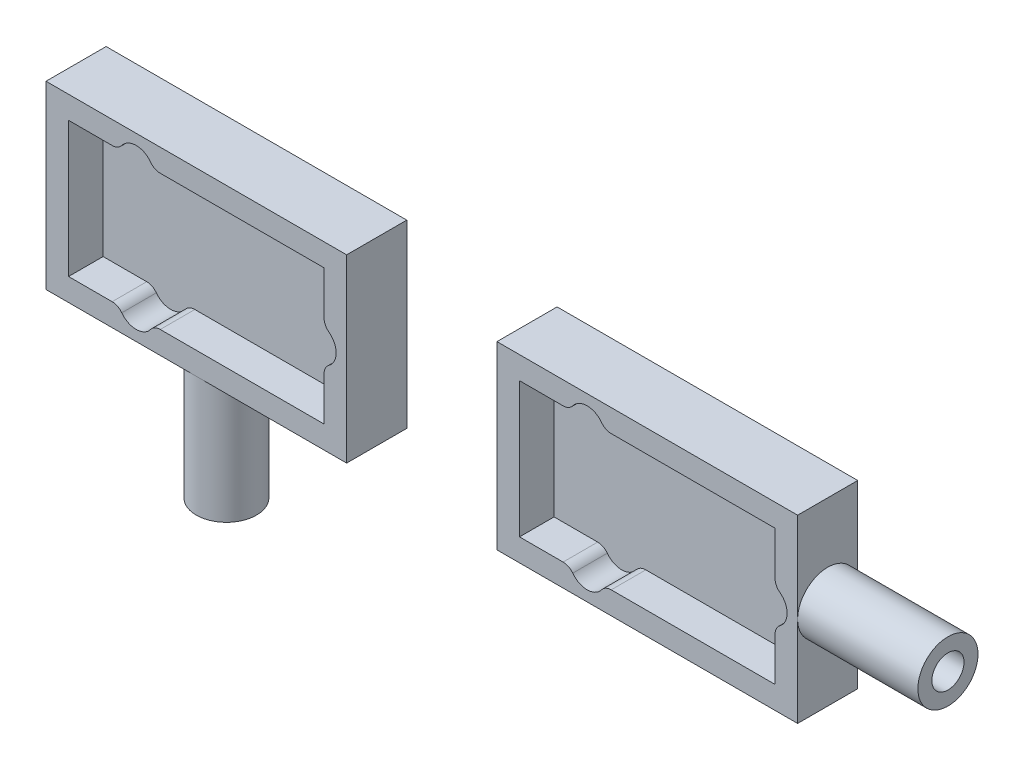
from build123d import *

# Parameters (mm, degrees)
SKETCH1_R           = 5
BOSS_EXTRUDE1_DEPTH = 20
SKETCH2_R           = 2.65
CUT_EXTRUDE1_DEPTH  = 12
SKETCH7_W           = 50
SKETCH7_H           = 30
BOSS_EXTRUDE4_DEPTH = 5
CUT_EXTRUDE2_DEPTH  = 0.75
CUT_EXTRUDE3_START  = 12
SKETCH8_3_R         = 1
CUT_EXTRUDE3_DEPTH  = 12
BOSS_EXTRUDE5_DEPTH = 20
SKETCH10_R          = 2.675
CUT_EXTRUDE4_DEPTH  = 12
SKETCH11_W          = 10
SKETCH11_H          = 20
CUT_EXTRUDE5_DEPTH  = 40
FILLET1_R           = 2
FILLET2_R           = 2


with BuildPart() as part:
    # Sketch1 → Boss-Extrude1 (new body)
    with BuildSketch(Plane(origin=(0, 0, 0), x_dir=(1, 0, 0), z_dir=(0, 1, 0))):
        with Locations(Location((0, 0, 0), (0, 0, 270))):
            Circle(SKETCH1_R)
    extrude(amount=BOSS_EXTRUDE1_DEPTH)

    # Sketch2 → Cut-Extrude1 (cut)
    with BuildSketch(Plane.XZ):
        with Locations(Location((0, 0, 0), (0, 0, 270))):
            Circle(SKETCH2_R)
    extrude(amount=-CUT_EXTRUDE1_DEPTH, mode=Mode.SUBTRACT)

    # Sketch7 → Boss-Extrude4 (add, symmetric)
    with BuildSketch(Plane.XY):
        with Locations((0, 35)):
            Rectangle(SKETCH7_W, SKETCH7_H)
    extrude(amount=BOSS_EXTRUDE4_DEPTH, both=True)

    # Sketch8 → Cut-Extrude2 (cut, symmetric)
    # profile 1 of 2: a face of its own
    with BuildSketch(Plane.XY):
        with BuildLine():
            Line((-21.25, 23.75), (-12.828427125, 23.75))
            ThreePointArc((-12.828427125, 23.75), (-10, 21.75), (-7.171572875, 23.75))
            Line((-7.171572875, 23.75), (10, 23.75))
            Line((10, 23.75), (21.25, 23.75))
            Line((21.25, 23.75), (21.25, 32.171572875))
            ThreePointArc((21.25, 32.171572875), (23.25, 35), (21.25, 37.828427125))
            Line((21.25, 37.828427125), (21.25, 46.25))
            Line((21.25, 46.25), (10, 46.25))
            Line((10, 46.25), (-7.171572875, 46.25))
            ThreePointArc((-7.171572875, 46.25), (-10, 48.25), (-12.828427125, 46.25))
            Line((-12.828427125, 46.25), (-21.25, 46.25))
            Line((-21.25, 46.25), (-21.25, 23.75))
        make_face()
        with BuildLine():
            Line((12, 24.75), (20.25, 24.75))
            Line((20.25, 24.75), (20.25, 33))
            ThreePointArc((20.25, 33), (22.25, 35), (20.25, 37))
            Line((20.25, 37), (20.25, 45.25))
            Line((20.25, 45.25), (12, 45.25))
            ThreePointArc((12, 45.25), (10, 43.25), (8, 45.25))
            Line((8, 45.25), (-8, 45.25))
            ThreePointArc((-8, 45.25), (-10, 47.25), (-12, 45.25))
            Line((-12, 45.25), (-20.25, 45.25))
            Line((-20.25, 45.25), (-20.25, 24.75))
            Line((-20.25, 24.75), (-12, 24.75))
            ThreePointArc((-12, 24.75), (-10, 22.75), (-8, 24.75))
            Line((-8, 24.75), (8, 24.75))
            ThreePointArc((8, 24.75), (10, 26.75), (12, 24.75))
        make_face(mode=Mode.SUBTRACT)
    # profile 2 of 2: a face of its own
    with BuildSketch(Plane.XY):
        with BuildLine():
            ThreePointArc((12, 24.75), (10, 26.75), (8, 24.75))
            Line((8, 24.75), (-8, 24.75))
            ThreePointArc((-8, 24.75), (-10, 22.75), (-12, 24.75))
            Line((-12, 24.75), (-20.25, 24.75))
            Line((-20.25, 24.75), (-20.25, 45.25))
            Line((-20.25, 45.25), (-12, 45.25))
            ThreePointArc((-12, 45.25), (-10, 47.25), (-8, 45.25))
            Line((-8, 45.25), (8, 45.25))
            ThreePointArc((8, 45.25), (10, 43.25), (12, 45.25))
            Line((12, 45.25), (20.25, 45.25))
            Line((20.25, 45.25), (20.25, 37))
            ThreePointArc((20.25, 37), (22.25, 35), (20.25, 33))
            Line((20.25, 33), (20.25, 24.75))
            Line((20.25, 24.75), (12, 24.75))
        make_face()
    extrude(amount=CUT_EXTRUDE2_DEPTH, both=True, mode=Mode.SUBTRACT)

    # Sketch8<3> → Cut-Extrude3 (cut)
    with BuildSketch(Plane.XY.offset(CUT_EXTRUDE3_START)):
        with BuildLine():
            Line((-21.25, 46.25), (-12.828427125, 46.25))
            ThreePointArc((-12.828427125, 46.25), (-10, 48.25), (-7.171572875, 46.25))
            Line((-7.171572875, 46.25), (10, 46.25))
            Line((10, 46.25), (21.25, 46.25))
            Line((21.25, 46.25), (21.25, 37.828427125))
            ThreePointArc((21.25, 37.828427125), (23.25, 35), (21.25, 32.171572875))
            Line((21.25, 32.171572875), (21.25, 23.75))
            Line((21.25, 23.75), (10, 23.75))
            Line((10, 23.75), (-7.171572875, 23.75))
            ThreePointArc((-7.171572875, 23.75), (-10, 21.75), (-12.828427125, 23.75))
            Line((-12.828427125, 23.75), (-21.25, 23.75))
            Line((-21.25, 23.75), (-21.25, 46.25))
        make_face()
        with Locations((10, 45.25)):
            Circle(SKETCH8_3_R, mode=Mode.SUBTRACT)
        with Locations((10, 24.75)):
            Circle(SKETCH8_3_R, mode=Mode.SUBTRACT)
    extrude(amount=-CUT_EXTRUDE3_DEPTH, mode=Mode.SUBTRACT)


with BuildPart() as cut_extrude3_kept_piece:
    # of the separate pieces the step leaves, the one the design keeps (cut_extrude3_pieces_kept)
    add(part.part.solids().sort_by_distance((-21.25, 23.75, -0.75))[0])


with BuildPart() as body_2:
    # Body-Move/Copy1: copy of Cut-Extrude3 kept piece
    add(cut_extrude3_kept_piece.part.moved(Location((75, 0, 0))))

    # Sketch9 → Boss-Extrude5 (add)
    with BuildSketch(Plane(origin=(100, 0, 0), x_dir=(0, 0, -1), z_dir=(1, 0, 0))):
        with BuildLine():
            ThreePointArc((2.675, 35), (1.89151064, 36.89151064), (0, 37.675))
            Line((0, 37.675), (0, 32.325))
            ThreePointArc((0, 32.325), (1.89151064, 33.10848936), (2.675, 35))
        make_face()
        with BuildLine():
            Line((0, 32.325), (0, 37.675))
            ThreePointArc((0, 37.675), (-2.675, 35), (0, 32.325))
        make_face()
        with BuildLine():
            ThreePointArc((5, 35), (3.535533906, 38.535533906), (0, 40))
            Line((0, 40), (0, 37.675))
            ThreePointArc((0, 37.675), (1.89151064, 36.89151064), (2.675, 35))
            ThreePointArc((2.675, 35), (1.89151064, 33.10848936), (0, 32.325))
            Line((0, 32.325), (0, 30))
            ThreePointArc((0, 30), (3.535533906, 31.464466094), (5, 35))
        make_face()
        with BuildLine():
            Line((0, 37.675), (0, 40))
            ThreePointArc((0, 40), (-5, 35), (0, 30))
            Line((0, 30), (0, 32.325))
            ThreePointArc((0, 32.325), (-2.675, 35), (0, 37.675))
        make_face()
    extrude(amount=BOSS_EXTRUDE5_DEPTH)

    # Sketch10 → Cut-Extrude4 (cut)
    with BuildSketch(Plane(origin=(120, 0, 0), x_dir=(0, 0, -1), z_dir=(1, 0, 0))):
        with Locations((0, 35)):
            Circle(SKETCH10_R)
    extrude(amount=-CUT_EXTRUDE4_DEPTH, mode=Mode.SUBTRACT)

    # Sketch11 → Cut-Extrude5 (cut)
    with BuildSketch(Plane(origin=(100, 0, 0), x_dir=(0, 0, -1), z_dir=(1, 0, 0))):
        with Locations((0, 10)):
            Rectangle(SKETCH11_W, SKETCH11_H)
    extrude(amount=-CUT_EXTRUDE5_DEPTH, mode=Mode.SUBTRACT)

    # Fillet2
    fillet2_edges = [body_2.edges().sort_by_distance(p)[0] for p in [
        (62.171572875, 46.25, 2.125),
        (67.828427125, 46.25, 2.125),
        (96.25, 37.828427125, 2.125),
        (96.25, 32.171572875, 2.125),
        (67.828427125, 23.75, 2.125),
        (62.171572875, 23.75, 2.125),
    ]]
    fillet(fillet2_edges, radius=FILLET2_R)


with BuildPart() as cut_extrude3_kept_piece_1:
    add(cut_extrude3_kept_piece.part)

    # Fillet1
    fillet1_edges = [cut_extrude3_kept_piece_1.edges().sort_by_distance(p)[0] for p in [
        (-12.828427125, 46.25, 2.125),
        (-7.171572875, 46.25, 2.875),
        (21.25, 37.828427125, 2.125),
        (21.25, 32.171572875, 2.125),
        (-7.171572875, 23.75, 2.125),
        (-12.828427125, 23.75, 2.125),
    ]]
    fillet(fillet1_edges, radius=FILLET1_R)


solid = Compound([body_2.part, cut_extrude3_kept_piece_1.part])
